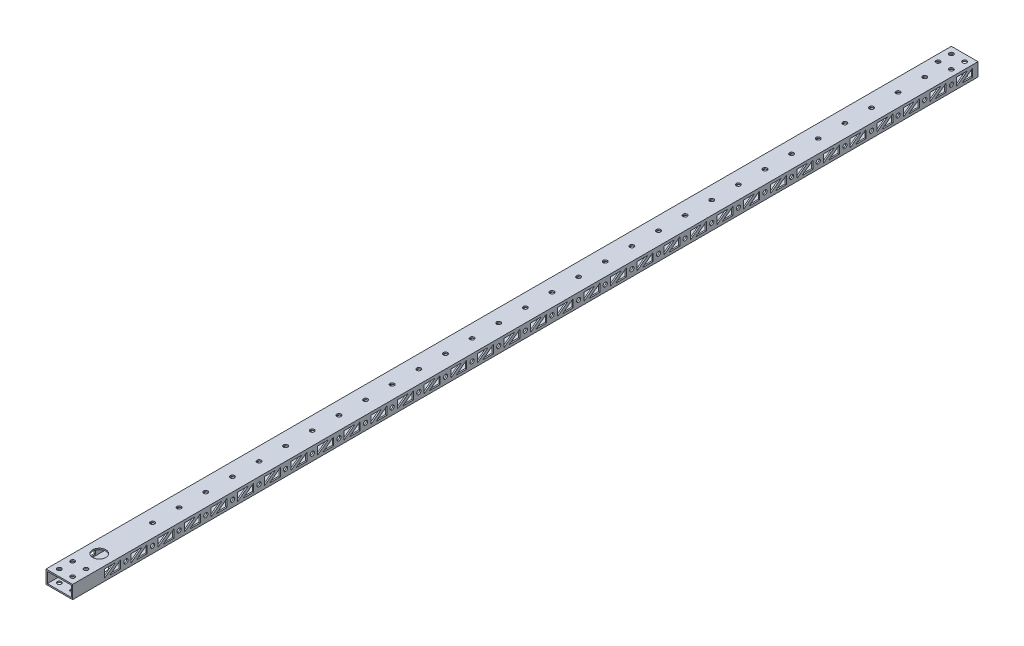
from build123d import *

# Parameters (mm, degrees)
SKETCH_1_W          = 20
SKETCH_1_H          = 10
SKETCH_1_W_2        = 18
SKETCH_1_H_2        = 8
EXTRUDE_1_DEPTH     = 680
SKETCH_2_R          = 1.575
SKETCH_2_R_2        = 5
CUT_EXTRUDE_1_DEPTH = 681.367547727
SKETCH_4_R          = 1.575
CUT_EXTRUDE_2_DEPTH = 681.367547727


with BuildPart() as part:
    # 草图1 → 拉伸-薄壁1 (new body)
    with BuildSketch(Plane.XY):
        with Locations((10, -5)):
            Rectangle(SKETCH_1_W, SKETCH_1_H)
        with Locations((10, -5)):
            Rectangle(SKETCH_1_W_2, SKETCH_1_H_2, mode=Mode.SUBTRACT)
    extrude(amount=EXTRUDE_1_DEPTH)

    # 草图2 → 切除-拉伸1 (cut, through all)
    with BuildSketch(Plane.XZ.offset(10)):
        with Locations(Location((5, 5, 0), (0, 0, 270))):
            Circle(SKETCH_2_R)
        with Locations(Location((15, 5, 0), (0, 0, 270))):
            Circle(SKETCH_2_R)
        with Locations(Location((15, 15, 0), (0, 0, 270))):
            Circle(SKETCH_2_R)
        with Locations(Location((5, 15, 0), (0, 0, 270))):
            Circle(SKETCH_2_R)
        with Locations(Location((10, 30, 0), (0, 0, 270))):
            Circle(SKETCH_2_R)
        with Locations(Location((10, 50, 0), (0, 0, 270))):
            Circle(SKETCH_2_R)
        with Locations(Location((10, 70, 0), (0, 0, 270))):
            Circle(SKETCH_2_R)
        with Locations(Location((10, 90, 0), (0, 0, 270))):
            Circle(SKETCH_2_R)
        with Locations(Location((10, 110, 0), (0, 0, 270))):
            Circle(SKETCH_2_R)
        with Locations(Location((10, 130, 0), (0, 0, 270))):
            Circle(SKETCH_2_R)
        with Locations(Location((10, 150, 0), (0, 0, 270))):
            Circle(SKETCH_2_R)
        with Locations(Location((10, 170, 0), (0, 0, 270))):
            Circle(SKETCH_2_R)
        with Locations(Location((10, 190, 0), (0, 0, 270))):
            Circle(SKETCH_2_R)
        with Locations(Location((10, 210, 0), (0, 0, 270))):
            Circle(SKETCH_2_R)
        with Locations(Location((10, 230, 0), (0, 0, 270))):
            Circle(SKETCH_2_R)
        with Locations(Location((10, 250, 0), (0, 0, 270))):
            Circle(SKETCH_2_R)
        with Locations(Location((10, 270, 0), (0, 0, 270))):
            Circle(SKETCH_2_R)
        with Locations(Location((10, 290, 0), (0, 0, 270))):
            Circle(SKETCH_2_R)
        with Locations(Location((10, 310, 0), (0, 0, 270))):
            Circle(SKETCH_2_R)
        with Locations(Location((10, 330, 0), (0, 0, 270))):
            Circle(SKETCH_2_R)
        with Locations(Location((10, 350, 0), (0, 0, 270))):
            Circle(SKETCH_2_R)
        with Locations(Location((10, 370, 0), (0, 0, 270))):
            Circle(SKETCH_2_R)
        with Locations(Location((10, 390, 0), (0, 0, 270))):
            Circle(SKETCH_2_R)
        with Locations(Location((10, 410, 0), (0, 0, 270))):
            Circle(SKETCH_2_R)
        with Locations(Location((10, 430, 0), (0, 0, 270))):
            Circle(SKETCH_2_R)
        with Locations(Location((10, 450, 0), (0, 0, 270))):
            Circle(SKETCH_2_R)
        with Locations(Location((10, 470, 0), (0, 0, 270))):
            Circle(SKETCH_2_R)
        with Locations(Location((10, 490, 0), (0, 0, 270))):
            Circle(SKETCH_2_R)
        with Locations(Location((10, 510, 0), (0, 0, 270))):
            Circle(SKETCH_2_R)
        with Locations(Location((10, 530, 0), (0, 0, 270))):
            Circle(SKETCH_2_R)
        with Locations(Location((10, 550, 0), (0, 0, 270))):
            Circle(SKETCH_2_R)
        with Locations(Location((10, 570, 0), (0, 0, 270))):
            Circle(SKETCH_2_R)
        with Locations(Location((10, 590, 0), (0, 0, 270))):
            Circle(SKETCH_2_R)
        with Locations(Location((10, 610, 0), (0, 0, 270))):
            Circle(SKETCH_2_R)
        with Locations(Location((5, 665, 0), (0, 0, 270))):
            Circle(SKETCH_2_R)
        with Locations(Location((15, 665, 0), (0, 0, 270))):
            Circle(SKETCH_2_R)
        with Locations(Location((15, 675, 0), (0, 0, 270))):
            Circle(SKETCH_2_R)
        with Locations(Location((5, 675, 0), (0, 0, 270))):
            Circle(SKETCH_2_R)
        with Locations(Location((10, 650, 0), (0, 0, 270))):
            Circle(SKETCH_2_R_2)
    extrude(amount=-CUT_EXTRUDE_1_DEPTH, mode=Mode.SUBTRACT)

    # 草图4 → 切除-拉伸2 (cut, through all)
    with BuildSketch(Plane(origin=(20, 0, 0), x_dir=(0, 0, -1), z_dir=(1, 0, 0))):
        with Locations(Location((-20, -5, 0), (0, 0, 90))):
            Circle(SKETCH_4_R)
        with Locations(Location((-40, -5, 0), (0, 0, 90))):
            Circle(SKETCH_4_R)
        with Locations(Location((-60, -5, 0), (0, 0, 90))):
            Circle(SKETCH_4_R)
        with Locations(Location((-80, -5, 0), (0, 0, 90))):
            Circle(SKETCH_4_R)
        with Locations(Location((-100, -5, 0), (0, 0, 90))):
            Circle(SKETCH_4_R)
        with Locations(Location((-120, -5, 0), (0, 0, 90))):
            Circle(SKETCH_4_R)
        with Locations(Location((-140, -5, 0), (0, 0, 90))):
            Circle(SKETCH_4_R)
        with Locations(Location((-160, -5, 0), (0, 0, 90))):
            Circle(SKETCH_4_R)
        with Locations(Location((-180, -5, 0), (0, 0, 90))):
            Circle(SKETCH_4_R)
        with Locations(Location((-200, -5, 0), (0, 0, 90))):
            Circle(SKETCH_4_R)
        with Locations(Location((-220, -5, 0), (0, 0, 90))):
            Circle(SKETCH_4_R)
        with Locations(Location((-240, -5, 0), (0, 0, 90))):
            Circle(SKETCH_4_R)
        with Locations(Location((-260, -5, 0), (0, 0, 90))):
            Circle(SKETCH_4_R)
        with Locations(Location((-280, -5, 0), (0, 0, 90))):
            Circle(SKETCH_4_R)
        with Locations(Location((-300, -5, 0), (0, 0, 90))):
            Circle(SKETCH_4_R)
        with Locations(Location((-320, -5, 0), (0, 0, 90))):
            Circle(SKETCH_4_R)
        with Locations(Location((-340, -5, 0), (0, 0, 90))):
            Circle(SKETCH_4_R)
        with Locations(Location((-360, -5, 0), (0, 0, 90))):
            Circle(SKETCH_4_R)
        with Locations(Location((-380, -5, 0), (0, 0, 90))):
            Circle(SKETCH_4_R)
        with Locations(Location((-400, -5, 0), (0, 0, 90))):
            Circle(SKETCH_4_R)
        with Locations(Location((-420, -5, 0), (0, 0, 90))):
            Circle(SKETCH_4_R)
        with Locations(Location((-440, -5, 0), (0, 0, 90))):
            Circle(SKETCH_4_R)
        with Locations(Location((-460, -5, 0), (0, 0, 90))):
            Circle(SKETCH_4_R)
        with Locations(Location((-480, -5, 0), (0, 0, 90))):
            Circle(SKETCH_4_R)
        with Locations(Location((-500, -5, 0), (0, 0, 90))):
            Circle(SKETCH_4_R)
        with Locations(Location((-520, -5, 0), (0, 0, 90))):
            Circle(SKETCH_4_R)
        with Locations(Location((-540, -5, 0), (0, 0, 90))):
            Circle(SKETCH_4_R)
        with Locations(Location((-560, -5, 0), (0, 0, 90))):
            Circle(SKETCH_4_R)
        with Locations(Location((-580, -5, 0), (0, 0, 90))):
            Circle(SKETCH_4_R)
        with Locations(Location((-600, -5, 0), (0, 0, 90))):
            Circle(SKETCH_4_R)
        with Locations(Location((-620, -5, 0), (0, 0, 90))):
            Circle(SKETCH_4_R)
        with Locations(Location((-640, -5, 0), (0, 0, 90))):
            Circle(SKETCH_4_R)
        Polygon((-4, -2), (-4, -8), (-12, -8), align=None)
        Polygon((-8, -2), (-16, -8), (-16, -2), align=None)
        Polygon((-24, -2), (-24, -8), (-32, -8), align=None)
        Polygon((-36, -2), (-28, -2), (-36, -8), align=None)
        Polygon((-44, -2), (-44, -8), (-52, -8), align=None)
        Polygon((-56, -2), (-48, -2), (-56, -8), align=None)
        Polygon((-64, -2), (-64, -8), (-72, -8), align=None)
        Polygon((-76, -2), (-68, -2), (-76, -8), align=None)
        Polygon((-84, -2), (-84, -8), (-92, -8), align=None)
        Polygon((-96, -2), (-88, -2), (-96, -8), align=None)
        Polygon((-104, -2), (-104, -8), (-112, -8), align=None)
        Polygon((-116, -2), (-108, -2), (-116, -8), align=None)
        Polygon((-124, -2), (-124, -8), (-132, -8), align=None)
        Polygon((-136, -2), (-128, -2), (-136, -8), align=None)
        Polygon((-144, -2), (-144, -8), (-152, -8), align=None)
        Polygon((-156, -2), (-148, -2), (-156, -8), align=None)
        Polygon((-164, -2), (-164, -8), (-172, -8), align=None)
        Polygon((-176, -2), (-168, -2), (-176, -8), align=None)
        Polygon((-184, -2), (-184, -8), (-192, -8), align=None)
        Polygon((-196, -2), (-188, -2), (-196, -8), align=None)
        Polygon((-204, -2), (-204, -8), (-212, -8), align=None)
        Polygon((-216, -2), (-208, -2), (-216, -8), align=None)
        Polygon((-224, -2), (-224, -8), (-232, -8), align=None)
        Polygon((-236, -2), (-228, -2), (-236, -8), align=None)
        Polygon((-244, -2), (-244, -8), (-252, -8), align=None)
        Polygon((-256, -2), (-248, -2), (-256, -8), align=None)
        Polygon((-264, -2), (-264, -8), (-272, -8), align=None)
        Polygon((-276, -2), (-268, -2), (-276, -8), align=None)
        Polygon((-284, -2), (-284, -8), (-292, -8), align=None)
        Polygon((-296, -2), (-288, -2), (-296, -8), align=None)
        Polygon((-304, -2), (-304, -8), (-312, -8), align=None)
        Polygon((-316, -2), (-308, -2), (-316, -8), align=None)
        Polygon((-324, -2), (-324, -8), (-332, -8), align=None)
        Polygon((-336, -2), (-328, -2), (-336, -8), align=None)
        Polygon((-344, -2), (-344, -8), (-352, -8), align=None)
        Polygon((-356, -2), (-348, -2), (-356, -8), align=None)
        Polygon((-364, -2), (-364, -8), (-372, -8), align=None)
        Polygon((-376, -2), (-368, -2), (-376, -8), align=None)
        Polygon((-384, -2), (-384, -8), (-392, -8), align=None)
        Polygon((-396, -2), (-388, -2), (-396, -8), align=None)
        Polygon((-404, -2), (-404, -8), (-412, -8), align=None)
        Polygon((-416, -2), (-408, -2), (-416, -8), align=None)
        Polygon((-424, -2), (-424, -8), (-432, -8), align=None)
        Polygon((-436, -2), (-428, -2), (-436, -8), align=None)
        Polygon((-444, -2), (-444, -8), (-452, -8), align=None)
        Polygon((-456, -2), (-448, -2), (-456, -8), align=None)
        Polygon((-464, -2), (-464, -8), (-472, -8), align=None)
        Polygon((-476, -2), (-468, -2), (-476, -8), align=None)
        Polygon((-484, -2), (-484, -8), (-492, -8), align=None)
        Polygon((-496, -2), (-488, -2), (-496, -8), align=None)
        Polygon((-504, -2), (-504, -8), (-512, -8), align=None)
        Polygon((-516, -2), (-508, -2), (-516, -8), align=None)
        Polygon((-524, -2), (-524, -8), (-532, -8), align=None)
        Polygon((-536, -2), (-528, -2), (-536, -8), align=None)
        Polygon((-544, -2), (-544, -8), (-552, -8), align=None)
        Polygon((-556, -2), (-548, -2), (-556, -8), align=None)
        Polygon((-564, -2), (-564, -8), (-572, -8), align=None)
        Polygon((-576, -2), (-568, -2), (-576, -8), align=None)
        Polygon((-584, -2), (-584, -8), (-592, -8), align=None)
        Polygon((-596, -2), (-588, -2), (-596, -8), align=None)
        Polygon((-604, -2), (-604, -8), (-612, -8), align=None)
        Polygon((-616, -2), (-608, -2), (-616, -8), align=None)
        Polygon((-624, -2), (-624, -8), (-632, -8), align=None)
        Polygon((-636, -2), (-628, -2), (-636, -8), align=None)
        Polygon((-644, -2), (-644, -8), (-652, -8), align=None)
        Polygon((-656, -2), (-648, -2), (-656, -8), align=None)
    extrude(amount=-CUT_EXTRUDE_2_DEPTH, mode=Mode.SUBTRACT)


solid = part.part
